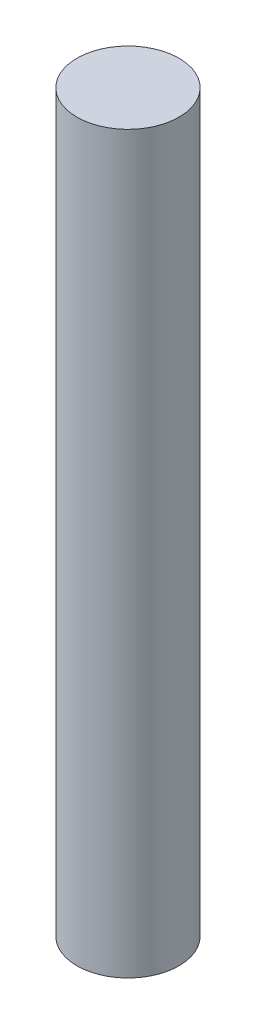
from build123d import *

# Parameters (mm, degrees)
SKETCH1_R           = 1.5875
BOSS_EXTRUDE1_DEPTH = 22.86


with BuildPart() as part:
    # Sketch1 → Boss-Extrude1 (new body)
    with BuildSketch(Plane(origin=(0, 0, 0), x_dir=(1, 0, 0), z_dir=(0, 1, 0))):
        with Locations(Location((0, 0, 0), (0, 0, 270))):
            Circle(SKETCH1_R)
    extrude(amount=BOSS_EXTRUDE1_DEPTH)


solid = part.part
